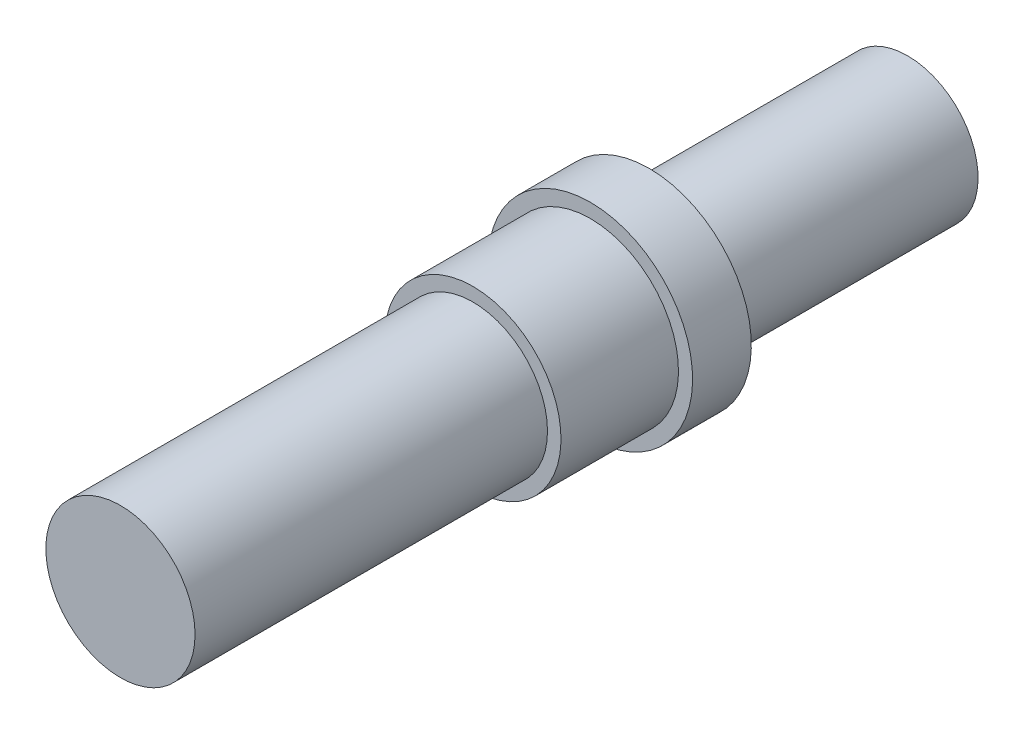
from build123d import *

# Parameters (mm, degrees)
SKETCH5_R             = 6.35
OUTSIDE_EXTRUDE_DEPTH = 30
INSIDE_START          = 2
SKETCH6_R             = 6
INSIDE_EXTRUDE_DEPTH  = 2


with BuildPart() as part:
    # Sketch3 → Initial Resolve -- Exact Length (revolve)
    with BuildSketch(Plane(origin=(0, 0, 0), x_dir=(0, 0, -1), z_dir=(1, 0, 0))):
        Polygon((9.998219577, 8.7), (14.998219577, 8.7), (14.998219577, 6), (34.998219577, 6), (34.998219577, 0), (0, 0), (-0.001780423, 0), (-0.001780423, 7.5), (9.998219577, 7.5), align=None)
    revolve(axis=Axis((0, 0, -34.998219577), (0, 0, 1)))

    # Sketch5 → Outside Extrude (add)
    with BuildSketch(Plane.XY.offset(0.001780423)):
        Circle(SKETCH5_R)
    extrude(amount=OUTSIDE_EXTRUDE_DEPTH)

    # Sketch6 → Inside Extrude (add)
    with BuildSketch(Plane(origin=(0, 0, -34.998219577), x_dir=(-1, 0, 0), z_dir=(0, 0, -1)).offset(INSIDE_START)):
        with Locations(Location((0, 0, 0), (0, 0, 90))):
            Circle(SKETCH6_R)
    extrude(amount=-INSIDE_EXTRUDE_DEPTH)


solid = part.part
